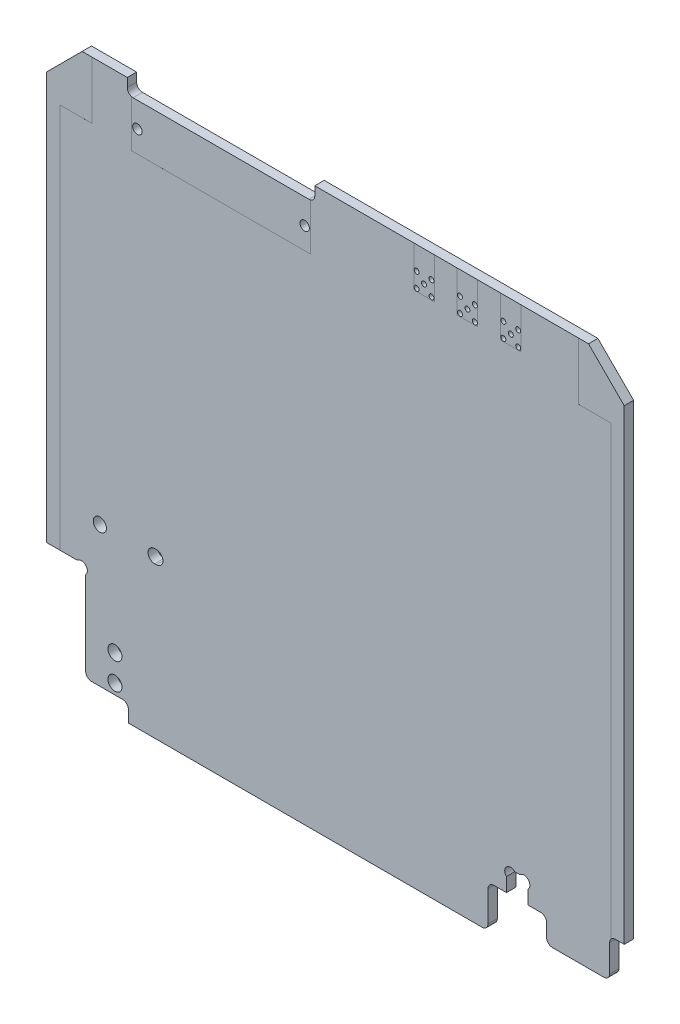
from build123d import *

# Parameters (mm, degrees)
SKETCH1_R           = 0.425
SKETCH1_R_2         = 0.8
BOSS_EXTRUDE1_DEPTH = 1.6
CUT_EXTRUDE1_DEPTH  = 0.0001
CUT_EXTRUDE2_DEPTH  = 0.0001
PARTFOOTPRINTS_W    = 30.48
PARTFOOTPRINTS_H    = 7.989227112
PARTFOOTPRINTS_W_2  = 3.5
PARTFOOTPRINTS_H_2  = 6.95
CUT_EXTRUDE3_DEPTH  = 0.0001
CUT_EXTRUDE4_DEPTH  = 71.235674696
SKETCH3_W           = 7.779754111
SKETCH3_H           = 5.155241991
CUT_EXTRUDE5_DEPTH  = 10
FILLET1_R           = 1
CUT_EXTRUDE6_DEPTH  = 71.235674696
FILLET2_R           = 1
SKETCH5_R           = 1.125
CUT_EXTRUDE7_DEPTH  = 71.235674696
SKETCH6_R           = 1.2
CUT_EXTRUDE8_DEPTH  = 71.235674696


with BuildPart() as part:
    # Sketch1 → Boss-Extrude1 (new body)
    with BuildSketch(Plane(origin=(0, 0, -0.0125), x_dir=(-1, 0, 0), z_dir=(0, 0, -1))):
        with BuildLine():
            Line((35.3, -50), (35.3, -48))
            ThreePointArc((35.3, -48), (35.592893219, -47.292893219), (36.3, -47))
            Line((36.3, -47), (45.8, -47))
            ThreePointArc((45.8, -47), (46.507106781, -46.707106781), (46.8, -46))
            Line((46.8, -46), (46.8, -41.4))
            ThreePointArc((46.8, -41.4), (47.092893219, -40.692893219), (47.8, -40.4))
            Line((47.8, -40.4), (49.3, -40.4))
            Line((49.3, -40.4), (49.3, 39.2))
            Line((49.3, 39.2), (43.2, 45.3))
            Line((43.2, 45.3), (35.500000002, 45.3))
            Line((35.500000002, 45.3), (35.500000002, 43.8))
            ThreePointArc((35.500000002, 43.8), (35.207106783, 43.092893219), (34.500000002, 42.8))
            Line((34.500000002, 42.8), (4.499999998, 42.8))
            ThreePointArc((4.499999998, 42.8), (3.792893217, 43.092893219), (3.499999998, 43.8))
            Line((3.499999998, 43.8), (3.499999998, 45.3))
            Line((3.499999998, 45.3), (-43.2, 45.3))
            Line((-43.2, 45.3), (-49.3, 39.2))
            Line((-49.3, 39.2), (-49.3, -40.4))
            Line((-49.3, -40.4), (-47.8, -40.4))
            ThreePointArc((-47.8, -40.4), (-47.092893219, -40.692893219), (-46.8, -41.4))
            Line((-46.8, -41.4), (-46.8, -46))
            ThreePointArc((-46.8, -46), (-46.507106781, -46.707106781), (-45.8, -47))
            Line((-45.8, -47), (-36.3, -47))
            ThreePointArc((-36.3, -47), (-35.592893219, -47.292893219), (-35.3, -48))
            Line((-35.3, -48), (-35.3, -50))
            Line((-35.3, -50), (35.3, -50))
        make_face()
        with Locations(Location((-21.27, 41.37, 0), (0, 0, 180))):
            Circle(SKETCH1_R, mode=Mode.SUBTRACT)
        with Locations(Location((-23.81, 41.37, 0), (0, 0, 180))):
            Circle(SKETCH1_R, mode=Mode.SUBTRACT)
        with Locations(Location((-22.54, 40.1, 0), (0, 0, 180))):
            Circle(SKETCH1_R, mode=Mode.SUBTRACT)
        with Locations(Location((-13.87, 41.37, 0), (0, 0, 180))):
            Circle(SKETCH1_R, mode=Mode.SUBTRACT)
        with Locations(Location((-23.81, 38.83, 0), (0, 0, 180))):
            Circle(SKETCH1_R, mode=Mode.SUBTRACT)
        with Locations(Location((-16.41, 41.37, 0), (0, 0, 180))):
            Circle(SKETCH1_R, mode=Mode.SUBTRACT)
        with Locations(Location((-15.14, 40.1, 0), (0, 0, 180))):
            Circle(SKETCH1_R, mode=Mode.SUBTRACT)
        with Locations(Location((-21.27, 38.83, 0), (0, 0, 180))):
            Circle(SKETCH1_R, mode=Mode.SUBTRACT)
        with Locations(Location((-28.67, 41.37, 0), (0, 0, 180))):
            Circle(SKETCH1_R, mode=Mode.SUBTRACT)
        with Locations(Location((-31.21, 41.37, 0), (0, 0, 180))):
            Circle(SKETCH1_R, mode=Mode.SUBTRACT)
        with Locations(Location((-16.41, 38.83, 0), (0, 0, 180))):
            Circle(SKETCH1_R, mode=Mode.SUBTRACT)
        with Locations(Location((-29.94, 40.1, 0), (0, 0, 180))):
            Circle(SKETCH1_R, mode=Mode.SUBTRACT)
        with Locations(Location((-31.21, 38.83, 0), (0, 0, 180))):
            Circle(SKETCH1_R, mode=Mode.SUBTRACT)
        with Locations(Location((-28.67, 38.83, 0), (0, 0, 180))):
            Circle(SKETCH1_R, mode=Mode.SUBTRACT)
        with Locations(Location((33.775, 38.54, 0), (0, 0, 180))):
            Circle(SKETCH1_R_2, mode=Mode.SUBTRACT)
        with Locations((5.225, 38.54)):
            Circle(SKETCH1_R_2, mode=Mode.SUBTRACT)
        with Locations(Location((-13.87, 38.83, 0), (0, 0, 180))):
            Circle(SKETCH1_R, mode=Mode.SUBTRACT)
    extrude(amount=-BOSS_EXTRUDE1_DEPTH)

    # thermalContacts_lower → Cut-Extrude1 (cut)
    with BuildSketch(Plane(origin=(0, 0, -0.0125), x_dir=(-1, 0, 0), z_dir=(0, 0, -1))):
        Polygon((47, 35.5), (47, -41.5), (59.827263463, -41.5), (59.827263463, 48.757689229), (41.5, 48.757689229), (41.5, 41.5), (41.5, 35.5), align=None)
        Polygon((-47, 35.5), (-47, -41.5), (-56.192158269, -41.5), (-56.192158269, 47), (-41.5, 47), (-41.5, 41.5), (-41.5, 35.5), align=None)
    extrude(amount=-CUT_EXTRUDE1_DEPTH, mode=Mode.SUBTRACT)

    # thermalContacts_upper → Cut-Extrude2 (cut)
    with BuildSketch(Plane.XY.offset(1.5875)):
        Polygon((-47, 35.5), (-47, -41.5), (-56.192158269, -41.5), (-56.192158269, 47), (-41.5, 47), (-41.5, 41.5), (-41.5, 35.5), align=None)
        Polygon((47, 35.5), (47, -41.5), (59.827263463, -41.5), (59.827263463, 47), (41.5, 47), (41.5, 41.5), (41.5, 35.5), align=None)
    extrude(amount=-CUT_EXTRUDE2_DEPTH, mode=Mode.SUBTRACT)

    # partFootprints → Cut-Extrude3 (cut)
    with BuildSketch(Plane.XY.offset(1.5875)):
        with Locations((-19.5, 38.834613556)):
            Rectangle(PARTFOOTPRINTS_W, PARTFOOTPRINTS_H)
        with Locations((15.14, 41.825)):
            Rectangle(PARTFOOTPRINTS_W_2, PARTFOOTPRINTS_H_2)
        with Locations((22.54, 41.825)):
            Rectangle(PARTFOOTPRINTS_W_2, PARTFOOTPRINTS_H_2)
        with Locations((29.94, 41.825)):
            Rectangle(PARTFOOTPRINTS_W_2, PARTFOOTPRINTS_H_2)
    extrude(amount=-CUT_EXTRUDE3_DEPTH, mode=Mode.SUBTRACT)

    # Sketch2 → Cut-Extrude4 (cut, through all)
    with BuildSketch(Plane.XY.offset(1.5875)):
        with BuildLine():
            Line((29.2, -42.8), (29.2, -40.414213562))
            ThreePointArc((29.2, -40.414213562), (29.2, -39), (30.614213562, -39))
            Line((30.614213562, -39), (31.485786438, -39))
            ThreePointArc((31.485786438, -39), (32.9, -39), (32.9, -40.414213562))
            Line((32.9, -40.414213562), (32.9, -42.8))
            Line((32.9, -42.8), (36.05, -42.8))
            Line((36.05, -42.8), (36.05, -50))
            Line((36.05, -50), (26.05, -50))
            Line((26.05, -50), (26.05, -42.8))
            Line((26.05, -42.8), (29.2, -42.8))
        make_face()
    extrude(amount=-CUT_EXTRUDE4_DEPTH, mode=Mode.SUBTRACT)

    # Sketch3 → Cut-Extrude5 (cut)
    with BuildSketch(Plane.XY.offset(1.5875)):
        with Locations((35.630924609, -49.577620995)):
            Rectangle(SKETCH3_W, SKETCH3_H)
    extrude(amount=-CUT_EXTRUDE5_DEPTH, mode=Mode.SUBTRACT)

    # Fillet1
    fillet1_edges = [part.edges().sort_by_distance(p)[0] for p in [
        (26.05, -50, 0.7875),
        (26.05, -42.8, 0.7875),
        (36.05, -42.8, 0.7875),
        (36.05, -47, 0.7875),
    ]]
    fillet(fillet1_edges, radius=FILLET1_R)

    # Sketch4 → Cut-Extrude6 (cut, through all)
    with BuildSketch(Plane.XY.offset(1.5875)):
        with BuildLine():
            Line((-51.38081647, -30.3), (-44.014213562, -30.3))
            ThreePointArc((-44.014213562, -30.3), (-42.6, -30.3), (-42.6, -31.714213562))
            Line((-42.6, -31.714213562), (-42.6, -47))
            Line((-42.6, -47), (-51.38081647, -47))
            Line((-51.38081647, -47), (-51.38081647, -30.3))
        make_face()
    extrude(amount=-CUT_EXTRUDE6_DEPTH, mode=Mode.SUBTRACT)

    # Fillet2
    fillet2_edges = [part.edges().sort_by_distance(p)[0] for p in [
        (-42.6, -47, 0.7875),
    ]]
    fillet(fillet2_edges, radius=FILLET2_R)

    # Sketch5 → Cut-Extrude7 (cut, through all)
    with BuildSketch(Plane.XY.offset(1.5875)):
        with Locations((-40.175, -23.1)):
            Circle(SKETCH5_R)
        with BuildLine():
            Line((-30.525, -24.225), (-30.825, -24.225))
            ThreePointArc((-30.825, -24.225), (-31.95, -23.1), (-30.825, -21.975))
            Line((-30.825, -21.975), (-30.525, -21.975))
            ThreePointArc((-30.525, -21.975), (-29.4, -23.1), (-30.525, -24.225))
        make_face()
    extrude(amount=-CUT_EXTRUDE7_DEPTH, mode=Mode.SUBTRACT)

    # Sketch6 → Cut-Extrude8 (cut, through all)
    with BuildSketch(Plane.XY.offset(1.5875)):
        with Locations((-37.6, -40.75)):
            Circle(SKETCH6_R)
        with Locations((-37.6, -45.25)):
            Circle(SKETCH6_R)
    extrude(amount=-CUT_EXTRUDE8_DEPTH, mode=Mode.SUBTRACT)


solid = part.part
